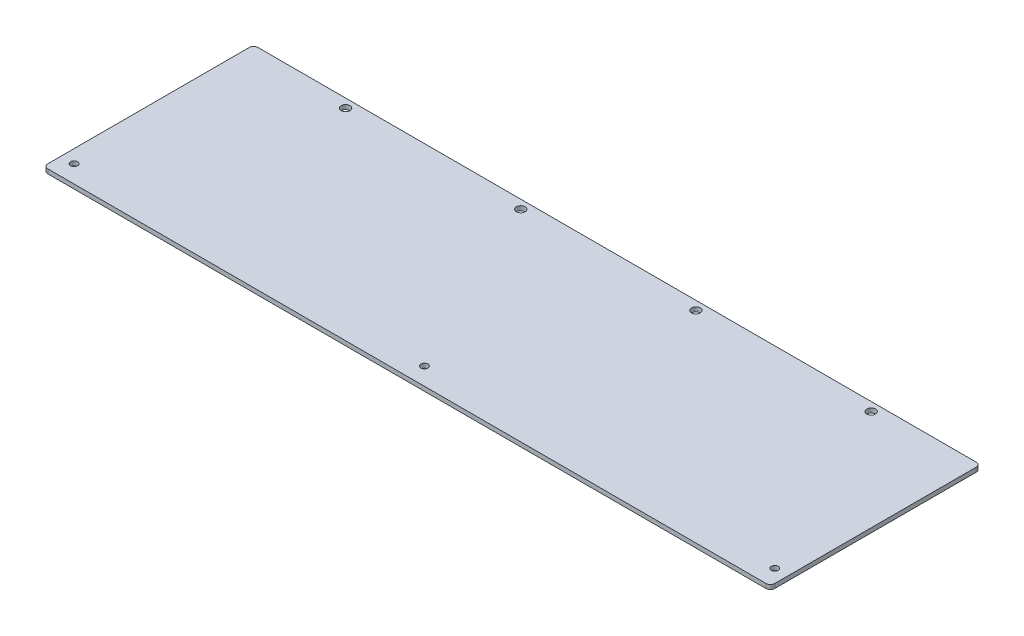
from build123d import *

# Parameters (mm, degrees)
SKETCH1_W                   = 527.05
SKETCH1_H                   = 152.4
BOSS_EXTRUDE1_DEPTH         = 3.175
F_7_0_201_DIAMETER_HOLE1_D  = 5.1054
FILLET1_R                   = 3.175
F_1_4_0_25_DIAMETER_HOLE1_D = 6.35


with BuildPart() as part:
    # Sketch1 → Boss-Extrude1 (new body)
    with BuildSketch(Plane(origin=(0, 0, 0), x_dir=(1, 0, 0), z_dir=(0, 1, 0))):
        Rectangle(SKETCH1_W, SKETCH1_H)
    extrude(amount=BOSS_EXTRUDE1_DEPTH)

    # #7 (0.201) Diameter Hole1 (through all)
    with Locations(Plane(origin=(0, 0, 0), x_dir=(-1, 0, 0), z_dir=(0, -1, 0))):
        with Locations((-254, -63.5), (0, -63.5), (254, -63.5)):
            Hole(F_7_0_201_DIAMETER_HOLE1_D / 2)

    # Fillet1
    fillet1_edges = [part.edges().sort_by_distance(p)[0] for p in [
        (263.525, 1.5875, 76.2),
        (-263.525, 1.5875, 76.2),
        (-263.525, 1.5875, -76.2),
        (263.525, 1.5875, -76.2),
    ]]
    fillet(fillet1_edges, radius=FILLET1_R)

    # 1/4 (0.25) Diameter Hole1 (through all)
    with Locations(Plane(origin=(0, 3.175, 0), x_dir=(1, 0, 0), z_dir=(0, 1, 0))):
        with Locations((190.5, 69.85), (63.5, 69.85), (-63.5, 69.85), (-190.5, 69.85)):
            Hole(F_1_4_0_25_DIAMETER_HOLE1_D / 2)


solid = part.part
